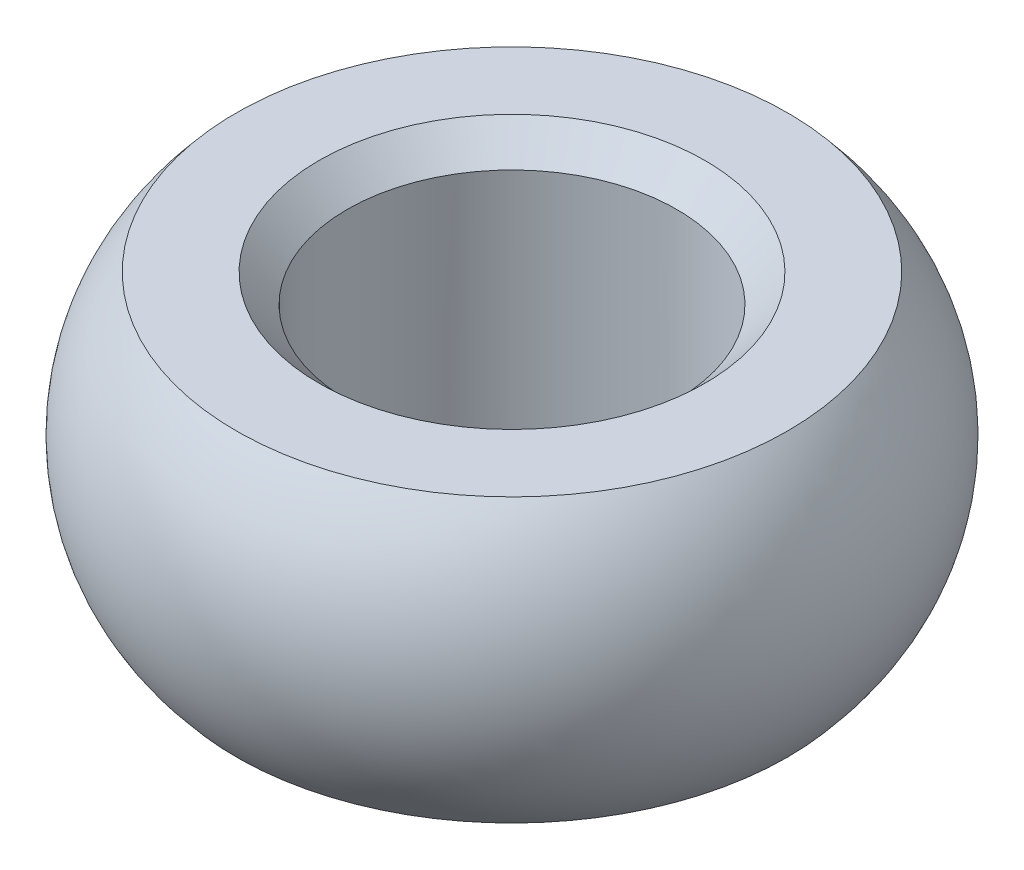
from build123d import *

# Parameters (mm, degrees)
CHAMFER1_SIZE = 3


with BuildPart() as part:
    # Sketch1 → Revolve1 (revolve)
    with BuildSketch(Plane.XY):
        with BuildLine():
            Line((29.270509831, 15), (17.5, 15))
            Line((17.5, 15), (17.5, -15))
            Line((17.5, -15), (29.270509831, -15))
            ThreePointArc((29.270509831, -15), (35, 0), (29.270509831, 15))
        make_face()
    revolve(axis=Axis((0, -482.629858818, 0), (0, 1, 0)))

    # Chamfer1
    chamfer1_edges = [part.edges().sort_by_distance(p)[0] for p in [
        (-17.5, 15, 0),
        (-17.5, -15, 0),
    ]]
    chamfer(chamfer1_edges, length=CHAMFER1_SIZE)


solid = part.part
